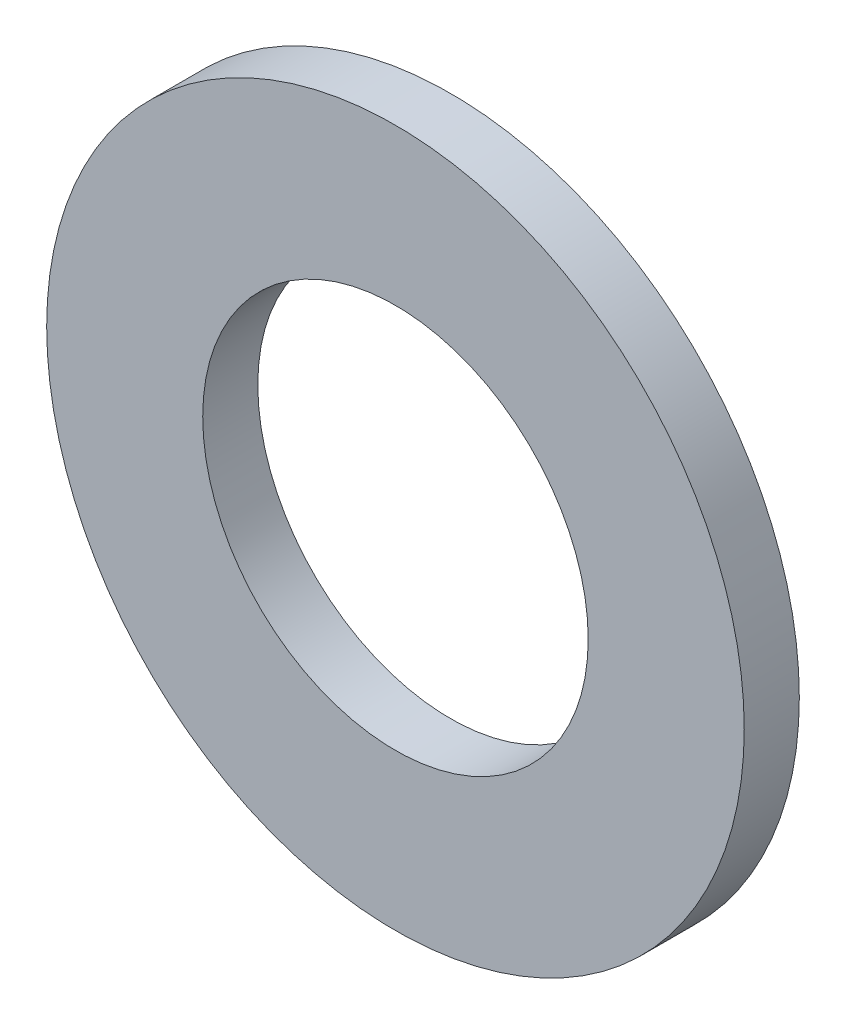
from build123d import *

# Parameters (mm, degrees)
SKETCH1_R    = 1.9
SKETCH1_R_2  = 1.05
WASHER_DEPTH = 0.3


with BuildPart() as part:
    # Sketch1 → Washer (new body)
    with BuildSketch(Plane.XY):
        Circle(SKETCH1_R)
        Circle(SKETCH1_R_2, mode=Mode.SUBTRACT)
    extrude(amount=WASHER_DEPTH)


solid = part.part
